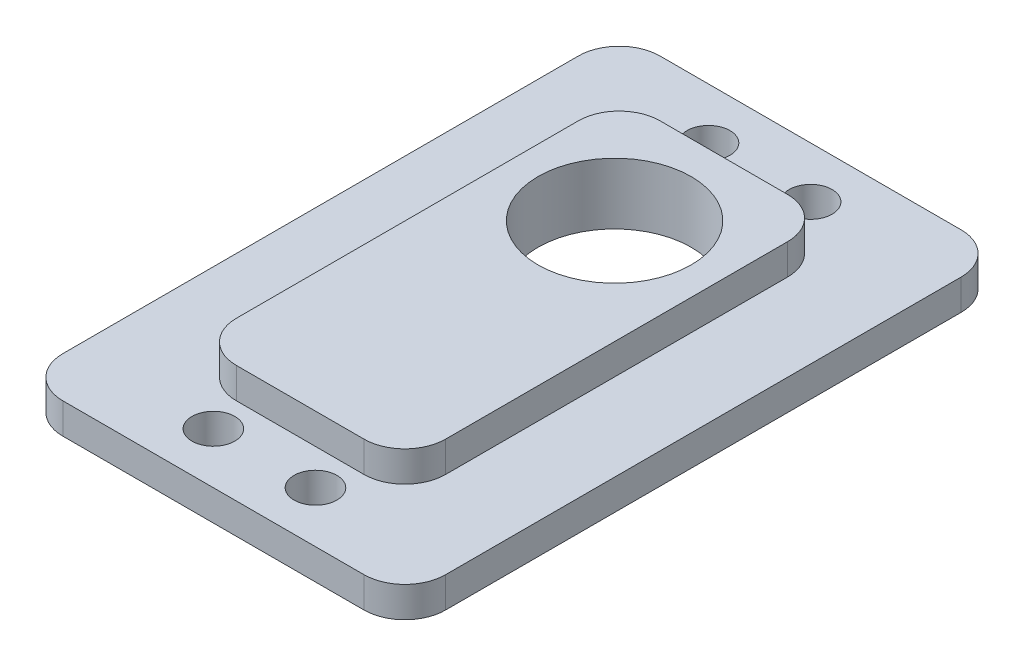
from build123d import *

# Parameters (mm, degrees)
SKETCH1_W           = 20.5
SKETCH1_H           = 41.5
SKETCH1_R           = 7.5
BOSS_EXTRUDE2_DEPTH = 6
SKETCH1_3_W         = 37.5
SKETCH1_3_H         = 58.5
SKETCH1_3_R         = 2.1
SKETCH1_3_W_2       = 20.5
SKETCH1_3_H_2       = 41.5
BOSS_EXTRUDE3_DEPTH = 3
FILLET1_R           = 4


with BuildPart() as part:
    # Sketch1 → Boss-Extrude2 (new body)
    with BuildSketch(Plane(origin=(0, 0, 0), x_dir=(1, 0, 0), z_dir=(0, 1, 0))):
        with Locations((0, -10.05)):
            Rectangle(SKETCH1_W, SKETCH1_H)
        Circle(SKETCH1_R, mode=Mode.SUBTRACT)
    extrude(amount=BOSS_EXTRUDE2_DEPTH)

    # Sketch1<3> → Boss-Extrude3 (add)
    with BuildSketch(Plane(origin=(0, 0, 0), x_dir=(1, 0, 0), z_dir=(0, 1, 0))):
        with Locations((0, -10.05)):
            Rectangle(SKETCH1_3_W, SKETCH1_3_H)
        with Locations((-5, -34.3)):
            Circle(SKETCH1_3_R, mode=Mode.SUBTRACT)
        with Locations((5, -34.3)):
            Circle(SKETCH1_3_R, mode=Mode.SUBTRACT)
        with Locations((-5, 14.2)):
            Circle(SKETCH1_3_R, mode=Mode.SUBTRACT)
        with Locations((0, -10.05)):
            Rectangle(SKETCH1_3_W_2, SKETCH1_3_H_2, mode=Mode.SUBTRACT)
        with Locations((5, 14.2)):
            Circle(SKETCH1_3_R, mode=Mode.SUBTRACT)
    extrude(amount=BOSS_EXTRUDE3_DEPTH)

    # Fillet1
    fillet1_edges = [part.edges().sort_by_distance(p)[0] for p in [
        (-18.75, 1.5, -19.2),
        (18.75, 1.5, -19.2),
        (18.75, 1.5, 39.3),
        (-18.75, 1.5, 39.3),
        (-10.25, 4.5, -10.7),
        (10.25, 4.5, -10.7),
        (10.25, 4.5, 30.8),
        (-10.25, 4.5, 30.8),
    ]]
    fillet(fillet1_edges, radius=FILLET1_R)


solid = part.part
